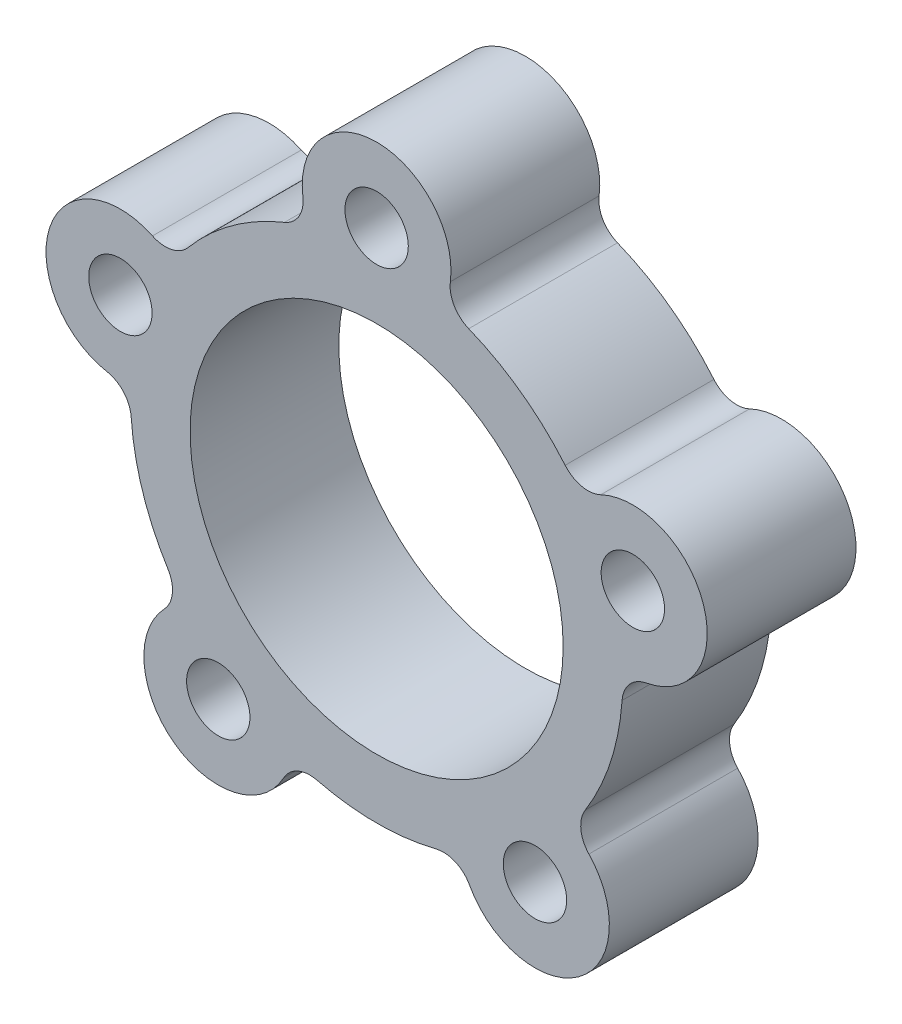
from build123d import *

# Parameters (mm, degrees)
SKETCH1_R             = 7.9629
BOSS_EXTRUDE1_DEPTH   = 6.35
F_6_32_TAPPED_HOLE1_D = 2.7051


with BuildPart() as part:
    # Sketch1 → Boss-Extrude1 (new body)
    with BuildSketch(Plane.XY.offset(10.16)):
        with BuildLine():
            ThreePointArc((8.047909304, 6.74848607), (6.173449726, 8.49702459), (3.931250908, 9.739413469))
            ThreePointArc((3.931250908, 9.739413469), (3.309450684, 10.277458281), (3.147581267, 11.08363818))
            ThreePointArc((3.147581267, 11.08363818), (0, 14.675), (-3.147581267, 11.08363818))
            ThreePointArc((-3.147581267, 11.08363818), (-3.309450684, 10.277458281), (-3.931250908, 9.739413469))
            ThreePointArc((-3.931250908, 9.739413469), (-6.173449726, 8.49702459), (-8.047909304, 6.74848607))
            ThreePointArc((-8.047909304, 6.74848607), (-8.751767166, 6.323383906), (-9.568510213, 6.418560232))
            ThreePointArc((-9.568510213, 6.418560232), (-13.956754377, 4.534824392), (-11.513822419, 0.431504882))
            ThreePointArc((-11.513822419, 0.431504882), (-10.797120172, 0.028434629), (-10.477555984, -0.729197516))
            ThreePointArc((-10.477555984, -0.729197516), (-9.988851485, -3.24557459), (-8.905132396, -5.568619705))
            ThreePointArc((-8.905132396, -5.568619705), (-8.718340254, -6.369392103), (-9.061245801, -7.116749798))
            ThreePointArc((-9.061245801, -7.116749798), (-8.625748577, -11.872324392), (-3.968352328, -10.816953497))
            ThreePointArc((-3.968352328, -10.816953497), (-3.363536563, -10.259884713), (-2.544234809, -10.190082318))
            ThreePointArc((-2.544234809, -10.190082318), (0, -10.5029), (2.544234809, -10.190082318))
            ThreePointArc((2.544234809, -10.190082318), (3.363536563, -10.259884713), (3.968352328, -10.816953497))
            ThreePointArc((3.968352328, -10.816953497), (8.625748577, -11.872324392), (9.061245801, -7.116749798))
            ThreePointArc((9.061245801, -7.116749798), (8.718340254, -6.369392103), (8.905132396, -5.568619705))
            ThreePointArc((8.905132396, -5.568619705), (9.988851485, -3.24557459), (10.477555984, -0.729197516))
            ThreePointArc((10.477555984, -0.729197516), (10.797120172, 0.028434629), (11.513822419, 0.431504882))
            ThreePointArc((11.513822419, 0.431504882), (13.956754377, 4.534824392), (9.568510213, 6.418560232))
            ThreePointArc((9.568510213, 6.418560232), (8.751767166, 6.323383906), (8.047909304, 6.74848607))
        make_face()
        Circle(SKETCH1_R, mode=Mode.SUBTRACT)
    extrude(amount=BOSS_EXTRUDE1_DEPTH)

    # #6-32 Tapped Hole1 (through all)
    with Locations(Plane.XY.offset(16.51)):
        with Locations((-10.937149937, 3.553695435), (0, 11.5), (10.937149937, 3.553695435), (6.759530401, -9.303695435), (-6.759530401, -9.303695435)):
            Hole(F_6_32_TAPPED_HOLE1_D / 2)


solid = part.part
